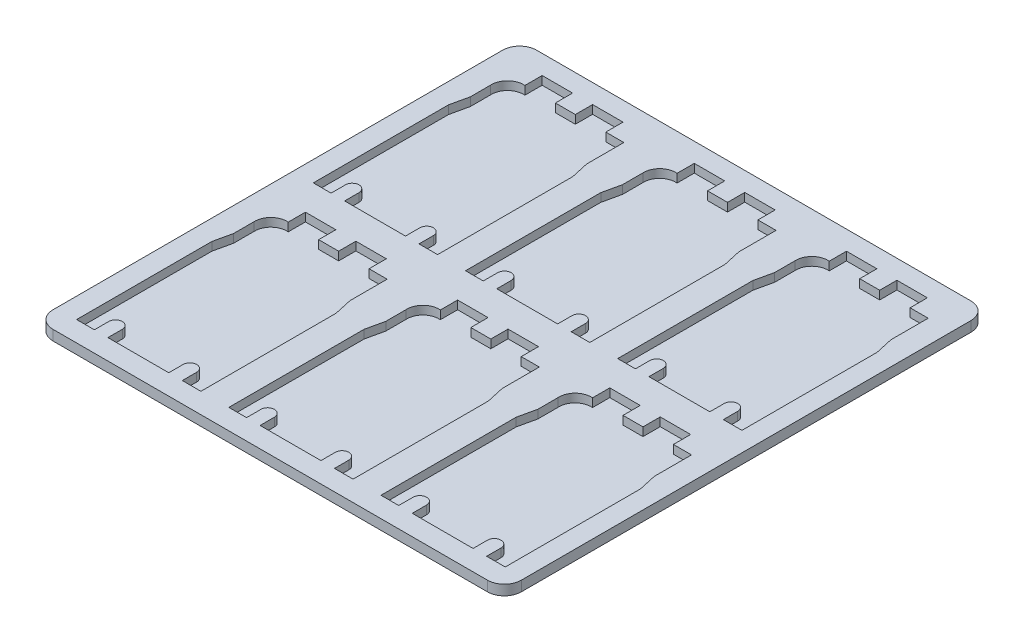
from build123d import *

# Parameters (mm, degrees)
BOSS_EXTRUDE1_DEPTH = 6
CUT_EXTRUDE1_DEPTH  = 5


with BuildPart() as part:
    # Sketch1 → Boss-Extrude1 (new body)
    with BuildSketch(Plane(origin=(0, 0, 0), x_dir=(1, 0, 0), z_dir=(0, 1, 0))):
        with BuildLine():
            Line((10, 0), (267, 0))
            ThreePointArc((267, 0), (274.071067812, 2.928932188), (277, 10))
            Line((277, 10), (277, 276))
            ThreePointArc((277, 276), (274.071067812, 283.071067812), (267, 286))
            Line((267, 286), (10, 286))
            ThreePointArc((10, 286), (2.928932188, 283.071067812), (0, 276))
            Line((0, 276), (0, 10))
            ThreePointArc((0, 10), (2.928932188, 2.928932188), (10, 0))
        make_face()
    extrude(amount=BOSS_EXTRUDE1_DEPTH)

    # Sketch2 → Cut-Extrude1 (cut)
    with BuildSketch(Plane(origin=(0, 6, 0), x_dir=(1, 0, 0), z_dir=(0, 1, 0))):
        with BuildLine():
            Line((12, 12), (22.5, 12))
            Line((22.5, 12), (22.5, 20.5))
            ThreePointArc((22.5, 20.5), (26.5, 24.5), (30.5, 20.5))
            Line((30.5, 20.5), (30.5, 12))
            Line((30.5, 12), (66.5, 12))
            Line((66.5, 12), (66.5, 20.5))
            ThreePointArc((66.5, 20.5), (70.5, 24.5), (74.5, 20.5))
            Line((74.5, 20.5), (74.5, 12))
            Line((74.5, 12), (85.5, 12))
            Line((85.5, 12), (85.5, 92))
            Line((85.5, 92), (83.159502005, 102.5))
            Line((83.159502005, 102.5), (83.159502005, 124.5))
            Line((83.159502005, 124.5), (72.459502005, 124.5))
            Line((72.459502005, 124.5), (72.459502005, 134.7))
            Line((72.459502005, 134.7), (54.459502005, 134.7))
            Line((54.459502005, 134.7), (54.459502005, 124.5))
            Line((54.459502005, 124.5), (42.659513404, 124.5))
            Line((42.659513404, 124.5), (42.659513404, 134.663480988))
            Line((42.659513404, 134.663480988), (24.659513404, 134.663480988))
            Line((24.659513404, 134.663480988), (24.659513404, 124.463480988))
            ThreePointArc((24.659513404, 124.463480988), (17.228582428, 121.834216678), (14.340497995, 114.5))
            Line((14.340497995, 114.5), (14.340497995, 102.5))
            Line((14.340497995, 102.5), (12, 92))
            Line((12, 92), (12, 12))
        make_face()
        with BuildLine():
            Line((114.659513404, 124.463480988), (114.659513404, 134.663480988))
            Line((114.659513404, 134.663480988), (132.659513404, 134.663480988))
            Line((132.659513404, 134.663480988), (132.659513404, 124.5))
            Line((132.659513404, 124.5), (144.459502005, 124.5))
            Line((144.459502005, 124.5), (144.459502005, 134.7))
            Line((144.459502005, 134.7), (162.459502005, 134.7))
            Line((162.459502005, 134.7), (162.459502005, 124.5))
            Line((162.459502005, 124.5), (173.159502005, 124.5))
            Line((173.159502005, 124.5), (173.159502005, 102.5))
            Line((173.159502005, 102.5), (175.5, 92))
            Line((175.5, 92), (175.5, 12))
            Line((175.5, 12), (164.5, 12))
            Line((164.5, 12), (164.5, 20.5))
            ThreePointArc((164.5, 20.5), (160.5, 24.5), (156.5, 20.5))
            Line((156.5, 20.5), (156.5, 12))
            Line((156.5, 12), (120.5, 12))
            Line((120.5, 12), (120.5, 20.5))
            ThreePointArc((120.5, 20.5), (116.5, 24.5), (112.5, 20.5))
            Line((112.5, 20.5), (112.5, 12))
            Line((112.5, 12), (102, 12))
            Line((102, 12), (102, 92))
            Line((102, 92), (104.340497995, 102.5))
            Line((104.340497995, 102.5), (104.340497995, 114.5))
            ThreePointArc((104.340497995, 114.5), (107.228582428, 121.834216678), (114.659513404, 124.463480988))
        make_face()
        with BuildLine():
            Line((204.659513404, 124.463480988), (204.659513404, 134.663480988))
            Line((204.659513404, 134.663480988), (222.659513404, 134.663480988))
            Line((222.659513404, 134.663480988), (222.659513404, 124.5))
            Line((222.659513404, 124.5), (234.459502005, 124.5))
            Line((234.459502005, 124.5), (234.459502005, 134.7))
            Line((234.459502005, 134.7), (252.459502005, 134.7))
            Line((252.459502005, 134.7), (252.459502005, 124.5))
            Line((252.459502005, 124.5), (263.159502005, 124.5))
            Line((263.159502005, 124.5), (263.159502005, 102.5))
            Line((263.159502005, 102.5), (265.5, 92))
            Line((265.5, 92), (265.5, 12))
            Line((265.5, 12), (254.5, 12))
            Line((254.5, 12), (254.5, 20.5))
            ThreePointArc((254.5, 20.5), (250.5, 24.5), (246.5, 20.5))
            Line((246.5, 20.5), (246.5, 12))
            Line((246.5, 12), (210.5, 12))
            Line((210.5, 12), (210.5, 20.5))
            ThreePointArc((210.5, 20.5), (206.5, 24.5), (202.5, 20.5))
            Line((202.5, 20.5), (202.5, 12))
            Line((202.5, 12), (192, 12))
            Line((192, 12), (192, 92))
            Line((192, 92), (194.340497995, 102.5))
            Line((194.340497995, 102.5), (194.340497995, 114.5))
            ThreePointArc((194.340497995, 114.5), (197.228582428, 121.834216678), (204.659513404, 124.463480988))
        make_face()
        with BuildLine():
            Line((114.659513404, 264.463480988), (114.659513404, 274.663480988))
            Line((114.659513404, 274.663480988), (132.659513404, 274.663480988))
            Line((132.659513404, 274.663480988), (132.659513404, 264.5))
            Line((132.659513404, 264.5), (144.459502005, 264.5))
            Line((144.459502005, 264.5), (144.459502005, 274.7))
            Line((144.459502005, 274.7), (162.459502005, 274.7))
            Line((162.459502005, 274.7), (162.459502005, 264.5))
            Line((162.459502005, 264.5), (173.159502005, 264.5))
            Line((173.159502005, 264.5), (173.159502005, 242.5))
            Line((173.159502005, 242.5), (175.5, 232))
            Line((175.5, 232), (175.5, 152))
            Line((175.5, 152), (164.5, 152))
            Line((164.5, 152), (164.5, 160.5))
            ThreePointArc((164.5, 160.5), (160.5, 164.5), (156.5, 160.5))
            Line((156.5, 160.5), (156.5, 152))
            Line((156.5, 152), (120.5, 152))
            Line((120.5, 152), (120.5, 160.5))
            ThreePointArc((120.5, 160.5), (116.5, 164.5), (112.5, 160.5))
            Line((112.5, 160.5), (112.5, 152))
            Line((112.5, 152), (102, 152))
            Line((102, 152), (102, 232))
            Line((102, 232), (104.340497995, 242.5))
            Line((104.340497995, 242.5), (104.340497995, 254.5))
            ThreePointArc((104.340497995, 254.5), (107.228582428, 261.834216678), (114.659513404, 264.463480988))
        make_face()
        with BuildLine():
            Line((204.659513404, 264.463480988), (204.659513404, 274.663480988))
            Line((204.659513404, 274.663480988), (222.659513404, 274.663480988))
            Line((222.659513404, 274.663480988), (222.659513404, 264.5))
            Line((222.659513404, 264.5), (234.459502005, 264.5))
            Line((234.459502005, 264.5), (234.459502005, 274.7))
            Line((234.459502005, 274.7), (252.459502005, 274.7))
            Line((252.459502005, 274.7), (252.459502005, 264.5))
            Line((252.459502005, 264.5), (263.159502005, 264.5))
            Line((263.159502005, 264.5), (263.159502005, 242.5))
            Line((263.159502005, 242.5), (265.5, 232))
            Line((265.5, 232), (265.5, 152))
            Line((265.5, 152), (254.5, 152))
            Line((254.5, 152), (254.5, 160.5))
            ThreePointArc((254.5, 160.5), (250.5, 164.5), (246.5, 160.5))
            Line((246.5, 160.5), (246.5, 152))
            Line((246.5, 152), (210.5, 152))
            Line((210.5, 152), (210.5, 160.5))
            ThreePointArc((210.5, 160.5), (206.5, 164.5), (202.5, 160.5))
            Line((202.5, 160.5), (202.5, 152))
            Line((202.5, 152), (192, 152))
            Line((192, 152), (192, 232))
            Line((192, 232), (194.340497995, 242.5))
            Line((194.340497995, 242.5), (194.340497995, 254.5))
            ThreePointArc((194.340497995, 254.5), (197.228582428, 261.834216678), (204.659513404, 264.463480988))
        make_face()
        with BuildLine():
            Line((24.659513404, 264.463480988), (24.659513404, 274.663480988))
            Line((24.659513404, 274.663480988), (42.659513404, 274.663480988))
            Line((42.659513404, 274.663480988), (42.659513404, 264.5))
            Line((42.659513404, 264.5), (54.459502005, 264.5))
            Line((54.459502005, 264.5), (54.459502005, 274.7))
            Line((54.459502005, 274.7), (72.459502005, 274.7))
            Line((72.459502005, 274.7), (72.459502005, 264.5))
            Line((72.459502005, 264.5), (83.159502005, 264.5))
            Line((83.159502005, 264.5), (83.159502005, 242.5))
            Line((83.159502005, 242.5), (85.5, 232))
            Line((85.5, 232), (85.5, 152))
            Line((85.5, 152), (74.5, 152))
            Line((74.5, 152), (74.5, 160.5))
            ThreePointArc((74.5, 160.5), (70.5, 164.5), (66.5, 160.5))
            Line((66.5, 160.5), (66.5, 152))
            Line((66.5, 152), (30.5, 152))
            Line((30.5, 152), (30.5, 160.5))
            ThreePointArc((30.5, 160.5), (26.5, 164.5), (22.5, 160.5))
            Line((22.5, 160.5), (22.5, 152))
            Line((22.5, 152), (12, 152))
            Line((12, 152), (12, 232))
            Line((12, 232), (14.340497995, 242.5))
            Line((14.340497995, 242.5), (14.340497995, 254.5))
            ThreePointArc((14.340497995, 254.5), (17.228582428, 261.834216678), (24.659513404, 264.463480988))
        make_face()
    extrude(amount=-CUT_EXTRUDE1_DEPTH, mode=Mode.SUBTRACT)


solid = part.part
